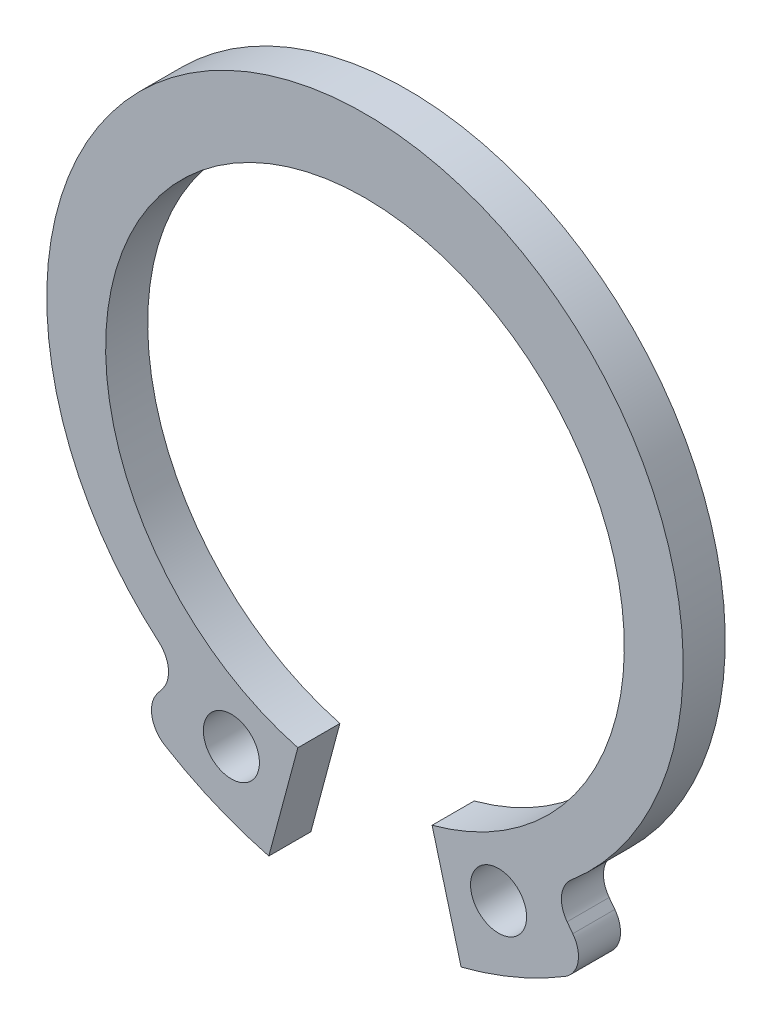
from build123d import *

# Parameters (mm, degrees)
ESQUISSE1_R          = 1
BASE_EXTRUSION_DEPTH = 1.5


with BuildPart() as part:
    # Esquisse1 → Base-Extrusion (new body)
    with BuildSketch(Plane.XY):
        with BuildLine():
            Line((7.209029703, -9.507825682), (7.412373516, -9.776011223))
            ThreePointArc((7.412373516, -9.776011223), (7.597932232, -10.566966478), (7.135063159, -11.234644899))
            ThreePointArc((7.135063159, -11.234644899), (5.339769929, -12.152978871), (3.429352348, -12.798517198))
            Line((3.429352348, -12.798517198), (2.394076167, -8.934813893))
            ThreePointArc((2.394076167, -8.934813893), (0, 9.25), (-2.394076167, -8.934813893))
            Line((-2.394076167, -8.934813893), (-3.429352348, -12.798517198))
            ThreePointArc((-3.429352348, -12.798517198), (-5.339769929, -12.152978871), (-7.135063159, -11.234644899))
            ThreePointArc((-7.135063159, -11.234644899), (-7.597932232, -10.566966478), (-7.412373516, -9.776011223))
            Line((-7.412373516, -9.776011223), (-7.209029703, -9.507825682))
            ThreePointArc((-7.209029703, -9.507825682), (-7.011742469, -8.795467512), (-7.357625498, -8.142213086))
            ThreePointArc((-7.357625498, -8.142213086), (0, 11.85), (7.357625498, -8.142213086))
            ThreePointArc((7.357625498, -8.142213086), (7.011742469, -8.795467512), (7.209029703, -9.507825682))
        make_face()
        with Locations((4.764569663, -10.084729396)):
            Circle(ESQUISSE1_R, mode=Mode.SUBTRACT)
        with Locations(Location((-4.764569663, -10.084729396, 0), (0, 0, 180))):
            Circle(ESQUISSE1_R, mode=Mode.SUBTRACT)
    extrude(amount=BASE_EXTRUSION_DEPTH)


solid = part.part
